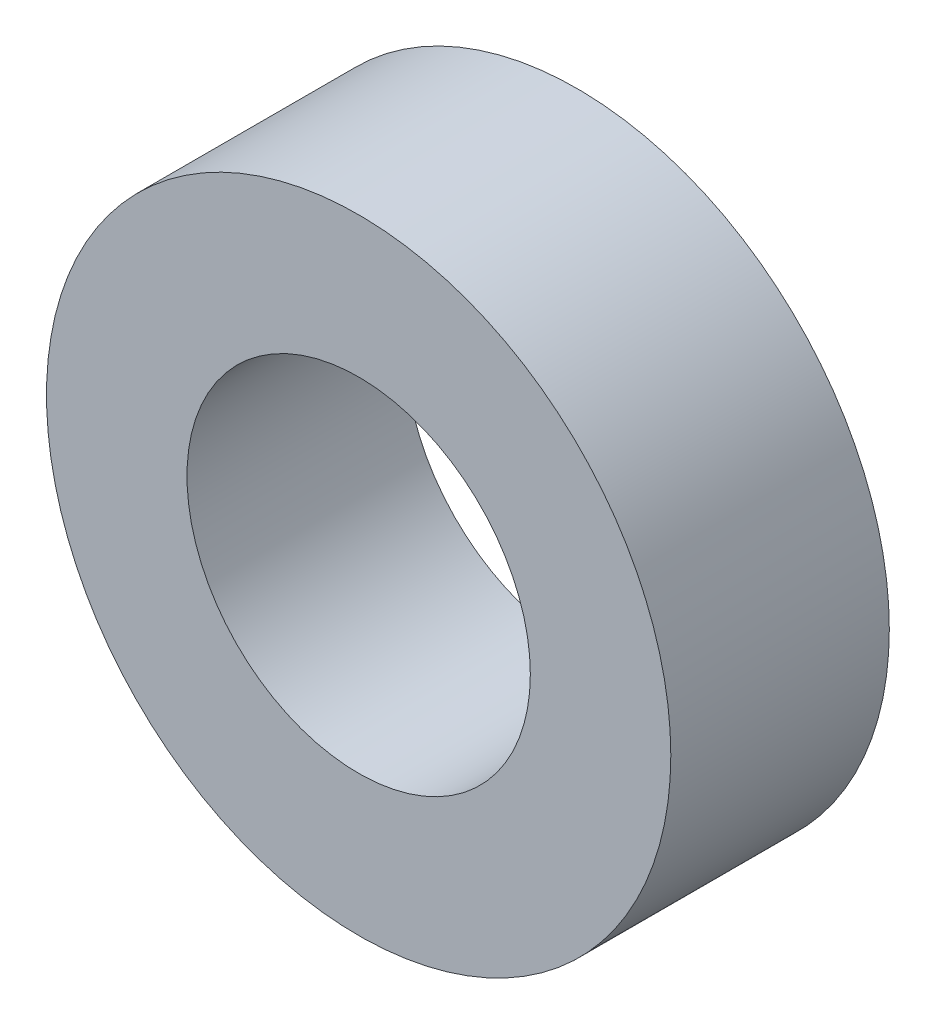
from build123d import *

# Parameters (mm, degrees)
TYRE_SWEPT_ENVELOPE_START = -17.5
PROFILE_1_R               = 50
PROFILE_1_R_2             = 27.5
TYRE_SWEPT_ENVELOPE_DEPTH = 35


with BuildPart() as part:
    # Profile_1 → Tyre_swept_envelope (new body)
    with BuildSketch(Plane.XY.offset(TYRE_SWEPT_ENVELOPE_START)):
        Circle(PROFILE_1_R)
        Circle(PROFILE_1_R_2, mode=Mode.SUBTRACT)
    extrude(amount=TYRE_SWEPT_ENVELOPE_DEPTH)


solid = part.part
